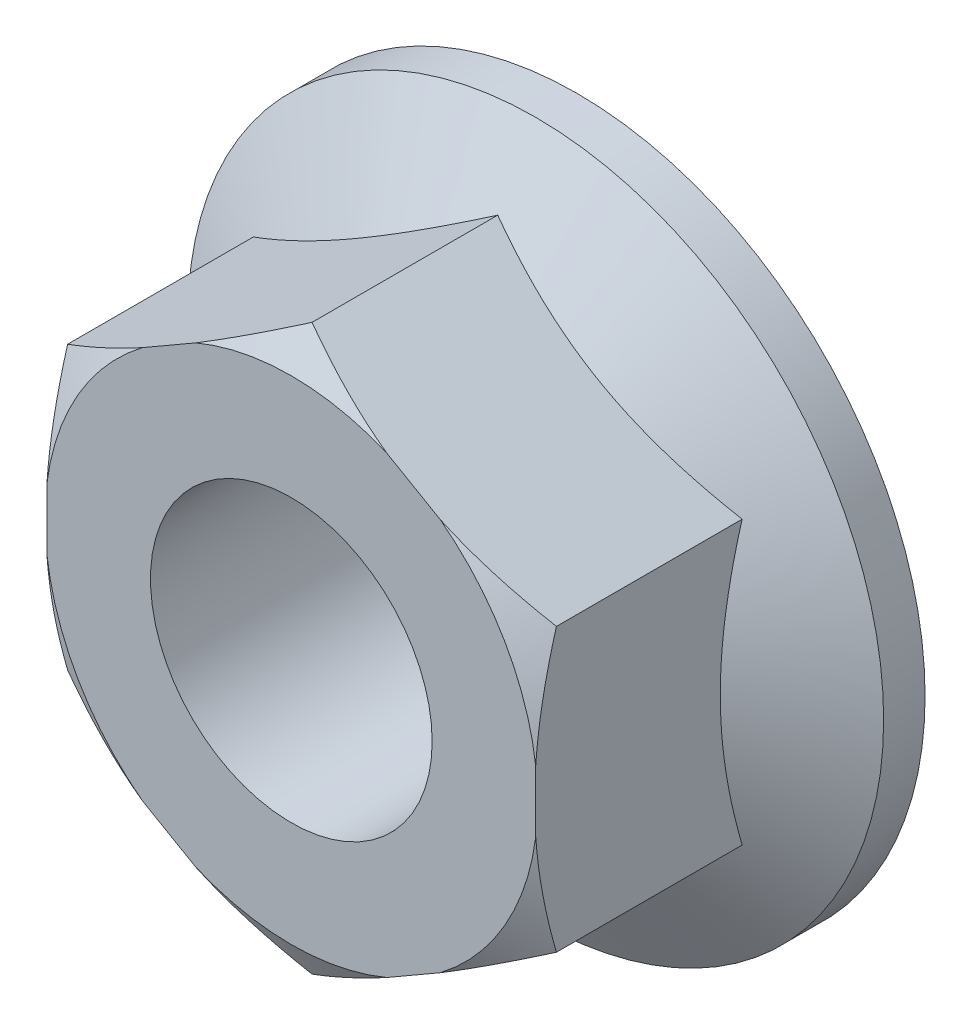
from build123d import *

# Parameters (mm, degrees)
BOSS_EXTRU_1_DEPTH = 6.9
TROU_TARAUD_M81_D  = 6.8


with BuildPart() as part:
    # Esquisse1 → Boss.-Extru.1 (new body)
    with BuildSketch(Plane.XY):
        Polygon((-5.9, -3.406366588), (0, -6.812733176), (5.9, -3.406366588), (5.9, 3.406366588), (0, 6.812733176), (-5.9, 3.406366588), align=None)
    extrude(amount=BOSS_EXTRU_1_DEPTH)

    # Esquisse2 → Révolution1 (revolve)
    with BuildSketch(Plane(origin=(0, 0, 0), x_dir=(0, 0, -1), z_dir=(1, 0, 0)), mode=Mode.PRIVATE) as r_volution1_sk:
        Polygon((-1, 8.4), (-2.5, 5.801923789), (-2.5, 0), (0, 0), (0, 8.4), align=None)
    revolve(r_volution1_sk.sketch.rotate(Axis((0, 0, 0), (0, 0, 1)), 90), axis=Axis((0, 0, 0), (0, 0, 1)))

    # Esquisse3 → Enlèvement de matière-Révolution1 (revolve, cut)
    with BuildSketch(Plane(origin=(0, 0, 0), x_dir=(0, 0, -1), z_dir=(1, 0, 0))):
        Polygon((-6.9, 6.812733176), (-6.9, 5.946707773), (-6.4, 6.812733176), align=None)
    revolve(axis=Axis((0, 0, 0), (0, 0, 1)), mode=Mode.SUBTRACT)

    # Trou taraudé M81 (through all)
    with Locations(Plane.XY.offset(6.9)):
        with Locations((0, 0)):
            Hole(TROU_TARAUD_M81_D / 2)


solid = part.part
